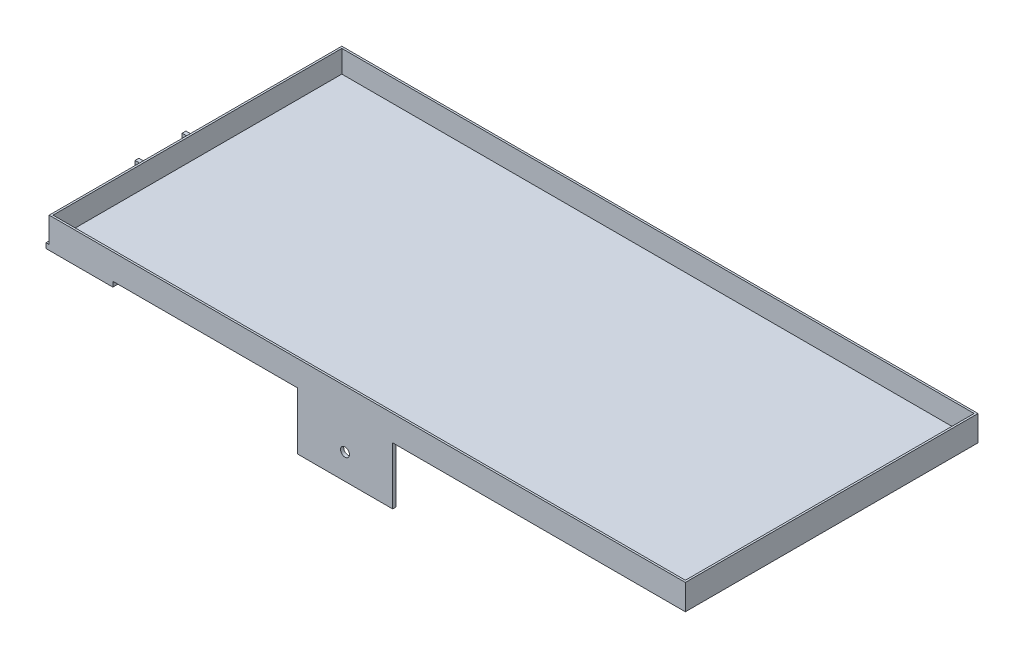
from build123d import *

# Parameters (mm, degrees)
ESQUISSE2_W                  = 1000
ESQUISSE2_H                  = 460
BOSS_EXTRU_1_DEPTH           = 40
ESQUISSE3_W                  = 150
ESQUISSE3_H                  = 5
BOSS_EXTRU_2_DEPTH           = 90
ENL_V_MAT_EXTRU_1_REACH      = 1106.4
ESQUISSE4_R                  = 7
ESQUISSE5_W                  = 105
ESQUISSE5_H                  = 460
BOSS_EXTRU_3_DEPTH           = 8
ESQUISSE6_W                  = 155
ESQUISSE6_H                  = 6
BOSS_EXTRU_4_DEPTH           = 40
CHANFREIN1_SIZE              = 30
CONG_1_R                     = 35
ENL_V_MAT_EXTRU_2_REACH      = 1041.711
ESQUISSE7_R                  = 7
ESQUISSE8_W                  = 994
ESQUISSE8_H                  = 454
ENL_V_MAT_EXTRU_3_DEPTH      = 35
CHANFREIN1_OF_SYM_TRIE1_SIZE = 30
CONG_1_OF_SYM_TRIE1_R        = 35


with BuildPart() as part:
    # Esquisse2 → Boss.-Extru.1 (new body)
    with BuildSketch(Plane(origin=(0, 0, 0), x_dir=(1, 0, 0), z_dir=(0, 1, 0))):
        with Locations((500, 0)):
            Rectangle(ESQUISSE2_W, ESQUISSE2_H)
    extrude(amount=BOSS_EXTRU_1_DEPTH)

    # Esquisse3 → Boss.-Extru.2 (add)
    with BuildSketch(Plane.XZ):
        with Locations((465, 227.5)):
            Rectangle(ESQUISSE3_W, ESQUISSE3_H)
    boss_extru_2 = extrude(amount=BOSS_EXTRU_2_DEPTH)

    # Esquisse4 → Enlèv. mat.-Extru.1 (cut, up to next)
    with BuildSketch(Plane.XY.offset(230), mode=Mode.PRIVATE) as enl_v_mat_extru_1_sk1:
        with Locations((465, -50)):
            Circle(ESQUISSE4_R)
    enl_v_mat_extru_1_tool1 = extrude(enl_v_mat_extru_1_sk1.sketch, amount=-ENL_V_MAT_EXTRU_1_REACH, mode=Mode.PRIVATE) & part.part
    enl_v_mat_extru_1 = enl_v_mat_extru_1_tool1.solids().sort_by_distance((465, -50, 230))[0]
    add(enl_v_mat_extru_1, mode=Mode.SUBTRACT)

    # Esquisse5 → Boss.-Extru.3 (add)
    with BuildSketch(Plane.XZ):
        with Locations((47.5, 0)):
            Rectangle(ESQUISSE5_W, ESQUISSE5_H)
    extrude(amount=BOSS_EXTRU_3_DEPTH)

    # Esquisse6 → Boss.-Extru.4 (add)
    with BuildSketch(Plane.XZ.offset(8)):
        with Locations((22.5, 37)):
            Rectangle(ESQUISSE6_W, ESQUISSE6_H)
    boss_extru_4 = extrude(amount=BOSS_EXTRU_4_DEPTH)

    # Chanfrein1
    chanfrein1_edges = [part.edges().sort_by_distance(p)[0] for p in [
        (100, -48, 37),
    ]]
    chamfer(chanfrein1_edges, length=CHANFREIN1_SIZE)

    # Congé1
    cong_1_edges = [part.edges().sort_by_distance(p)[0] for p in [
        (-55, -48, 37),
    ]]
    fillet(cong_1_edges, radius=CONG_1_R)

    # Esquisse7 → Enlèv. mat.-Extru.2 (cut, up to next)
    with BuildSketch(Plane.XY.offset(40), mode=Mode.PRIVATE) as enl_v_mat_extru_2_sk1:
        with Locations((-40, -20)):
            Circle(ESQUISSE7_R)
    enl_v_mat_extru_2_tool1 = extrude(enl_v_mat_extru_2_sk1.sketch, amount=-ENL_V_MAT_EXTRU_2_REACH, mode=Mode.PRIVATE) & part.part
    enl_v_mat_extru_2 = enl_v_mat_extru_2_tool1.solids().sort_by_distance((-40, -20, 40))[0]
    add(enl_v_mat_extru_2, mode=Mode.SUBTRACT)

    # Esquisse8 → Enlèv. mat.-Extru.3 (cut)
    with BuildSketch(Plane(origin=(0, 40, 0), x_dir=(1, 0, 0), z_dir=(0, 1, 0))):
        with Locations((500, 0)):
            Rectangle(ESQUISSE8_W, ESQUISSE8_H)
    extrude(amount=-ENL_V_MAT_EXTRU_3_DEPTH, mode=Mode.SUBTRACT)

    # Symétrie1: Boss.-Extru.2, Enlèv. mat.-Extru.1, Boss.-Extru.4, Enlèv. mat.-Extru.2 across plane
    add(boss_extru_2.mirror(Plane(origin=(0, 0, 0), x_dir=(1, 0, 0), z_dir=(0, 0, -1))))
    add(enl_v_mat_extru_1.mirror(Plane(origin=(0, 0, 0), x_dir=(1, 0, 0), z_dir=(0, 0, -1))), mode=Mode.SUBTRACT)
    add(boss_extru_4.mirror(Plane(origin=(0, 0, 0), x_dir=(1, 0, 0), z_dir=(0, 0, -1))))
    add(enl_v_mat_extru_2.mirror(Plane(origin=(0, 0, 0), x_dir=(1, 0, 0), z_dir=(0, 0, -1))), mode=Mode.SUBTRACT)

    # Chanfrein1 of Symétrie1
    chanfrein1_of_sym_trie1_edges = [part.edges().sort_by_distance(p)[0] for p in [
        (100, -48, -37),
    ]]
    chamfer(chanfrein1_of_sym_trie1_edges, length=CHANFREIN1_OF_SYM_TRIE1_SIZE)

    # Congé1 of Symétrie1
    cong_1_of_sym_trie1_edges = [part.edges().sort_by_distance(p)[0] for p in [
        (-55, -48, -37),
    ]]
    fillet(cong_1_of_sym_trie1_edges, radius=CONG_1_OF_SYM_TRIE1_R)


solid = part.part
